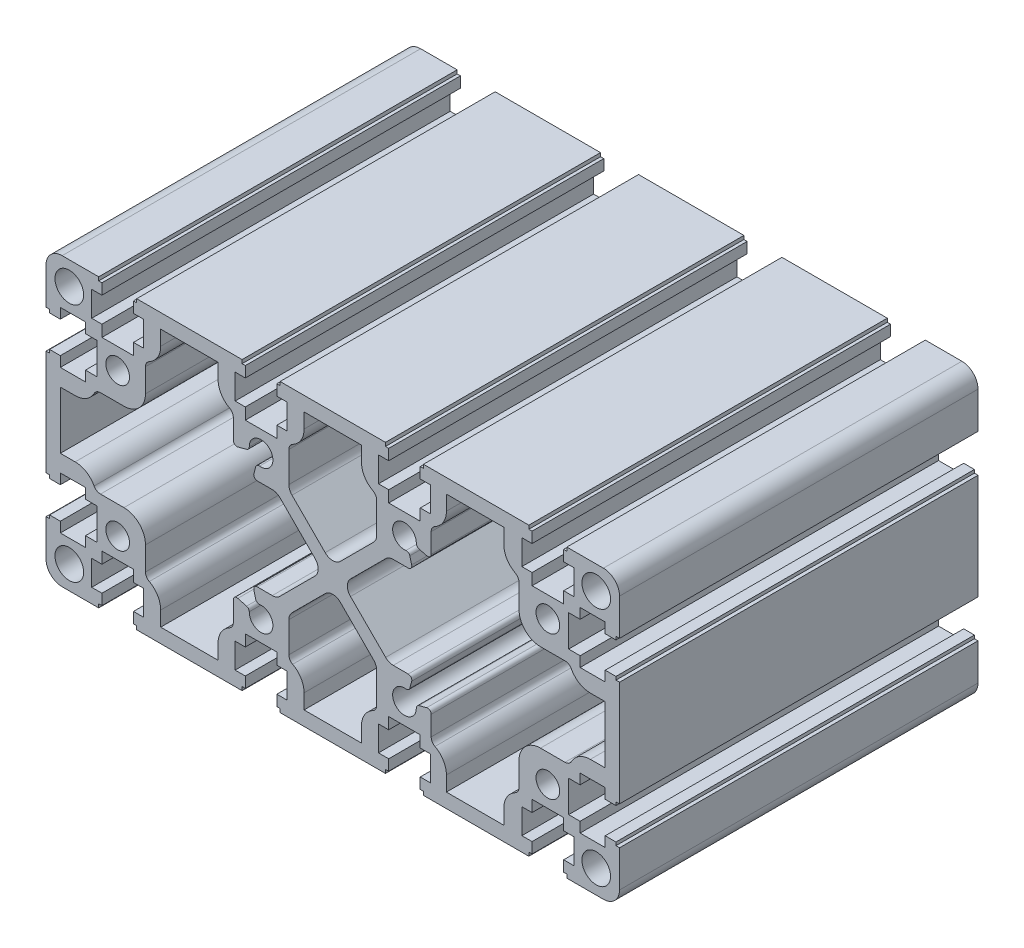
from build123d import *

# Parameters (mm, degrees)
SKETCH_1_R      = 3.3
SKETCH_1_R_2    = 4
EXTRUDE_1_DEPTH = 100
FILLET_1_R      = 3


with BuildPart() as part:
    # 草图1 → 凸台-拉伸1 (new body)
    with BuildSketch(Plane.XY):
        with BuildLine():
            Line((2558.354472588, -1547.201597776), (2587.754472588, -1547.201597776))
            Line((2587.754472588, -1547.201597776), (2587.754472588, -1548.201597776))
            Line((2587.754472588, -1548.201597776), (2588.654472588, -1548.201597776))
            Line((2588.654472588, -1548.201597776), (2588.654472588, -1551.201597776))
            Line((2588.654472588, -1551.201597776), (2585.804472588, -1551.201597776))
            Line((2585.804472588, -1551.201597776), (2585.804472588, -1558.201597776))
            Line((2585.804472588, -1558.201597776), (2588.654472588, -1558.201597776))
            Line((2588.654472588, -1558.201597776), (2588.654472588, -1561.401597776))
            Line((2588.654472588, -1561.401597776), (2597.454472588, -1561.401597776))
            Line((2597.454472588, -1561.401597776), (2597.454472588, -1558.201597776))
            Line((2597.454472588, -1558.201597776), (2600.304472588, -1558.201597776))
            Line((2600.304472588, -1558.201597776), (2600.304472588, -1551.201597776))
            Line((2600.304472588, -1551.201597776), (2597.454472588, -1551.201597776))
            Line((2597.454472588, -1551.201597776), (2597.454472588, -1548.201597776))
            Line((2597.454472588, -1548.201597776), (2598.354472588, -1548.201597776))
            Line((2598.354472588, -1548.201597776), (2598.354472588, -1547.201597776))
            Line((2598.354472588, -1547.201597776), (2627.754472588, -1547.201597776))
            Line((2627.754472588, -1547.201597776), (2627.754472588, -1548.201597776))
            Line((2627.754472588, -1548.201597776), (2628.654472588, -1548.201597776))
            Line((2628.654472588, -1548.201597776), (2628.654472588, -1551.201597776))
            Line((2628.654472588, -1551.201597776), (2625.804472588, -1551.201597776))
            Line((2625.804472588, -1551.201597776), (2625.804472588, -1558.201597776))
            Line((2625.804472588, -1558.201597776), (2628.654472588, -1558.201597776))
            Line((2628.654472588, -1558.201597776), (2628.654472588, -1561.401597776))
            Line((2628.654472588, -1561.401597776), (2637.454472588, -1561.401597776))
            Line((2637.454472588, -1561.401597776), (2637.454472588, -1558.201597776))
            Line((2637.454472588, -1558.201597776), (2640.304472588, -1558.201597776))
            Line((2640.304472588, -1558.201597776), (2640.304472588, -1551.201597776))
            Line((2640.304472588, -1551.201597776), (2637.454472588, -1551.201597776))
            Line((2637.454472588, -1551.201597776), (2637.454472588, -1548.201597776))
            Line((2637.454472588, -1548.201597776), (2638.354472588, -1548.201597776))
            Line((2638.354472588, -1548.201597776), (2638.354472588, -1547.201597776))
            Line((2638.354472588, -1547.201597776), (2667.754472588, -1547.201597776))
            Line((2667.754472588, -1547.201597776), (2667.754472588, -1548.201597776))
            Line((2667.754472588, -1548.201597776), (2668.654472588, -1548.201597776))
            Line((2668.654472588, -1548.201597776), (2668.654472588, -1551.201597776))
            Line((2668.654472588, -1551.201597776), (2665.804472588, -1551.201597776))
            Line((2665.804472588, -1551.201597776), (2665.804472588, -1558.201597776))
            Line((2665.804472588, -1558.201597776), (2668.654472588, -1558.201597776))
            Line((2668.654472588, -1558.201597776), (2668.654472588, -1561.401597776))
            Line((2668.654472588, -1561.401597776), (2677.454472588, -1561.401597776))
            Line((2677.454472588, -1561.401597776), (2677.454472588, -1558.201597776))
            Line((2677.454472588, -1558.201597776), (2680.304472588, -1558.201597776))
            Line((2680.304472588, -1558.201597776), (2680.304472588, -1551.201597776))
            Line((2680.304472588, -1551.201597776), (2677.454472588, -1551.201597776))
            Line((2677.454472588, -1551.201597776), (2677.454472588, -1548.201597776))
            Line((2677.454472588, -1548.201597776), (2678.354472588, -1548.201597776))
            Line((2678.354472588, -1548.201597776), (2678.354472588, -1547.201597776))
            Line((2678.354472588, -1547.201597776), (2688.554472588, -1547.201597776))
            ThreePointArc((2688.554472588, -1547.201597776), (2691.736453103, -1548.519617261), (2693.054472588, -1551.701597776))
            Line((2693.054472588, -1551.701597776), (2693.054472588, -1561.901597776))
            Line((2693.054472588, -1561.901597776), (2692.054472588, -1561.901597776))
            Line((2692.054472588, -1561.901597776), (2692.054472588, -1562.801597776))
            Line((2692.054472588, -1562.801597776), (2689.054472588, -1562.801597776))
            Line((2689.054472588, -1562.801597776), (2689.054472588, -1559.951597776))
            Line((2689.054472588, -1559.951597776), (2682.054472588, -1559.951597776))
            Line((2682.054472588, -1559.951597776), (2682.054472588, -1562.801597776))
            Line((2682.054472588, -1562.801597776), (2678.854472588, -1562.801597776))
            Line((2678.854472588, -1562.801597776), (2678.854472588, -1571.601597776))
            Line((2678.854472588, -1571.601597776), (2682.054472588, -1571.601597776))
            Line((2682.054472588, -1571.601597776), (2682.054472588, -1574.451597776))
            Line((2682.054472588, -1574.451597776), (2689.054472588, -1574.451597776))
            Line((2689.054472588, -1574.451597776), (2689.054472588, -1571.601597776))
            Line((2689.054472588, -1571.601597776), (2692.054472588, -1571.601597776))
            Line((2692.054472588, -1571.601597776), (2692.054472588, -1572.501597776))
            Line((2692.054472588, -1572.501597776), (2693.054472588, -1572.501597776))
            Line((2693.054472588, -1572.501597776), (2693.054472588, -1587.201597776))
            Line((2693.054472588, -1587.201597776), (2693.054472588, -1601.901597776))
            Line((2693.054472588, -1601.901597776), (2692.054472588, -1601.901597776))
            Line((2692.054472588, -1601.901597776), (2692.054472588, -1602.801597776))
            Line((2692.054472588, -1602.801597776), (2689.054472588, -1602.801597776))
            Line((2689.054472588, -1602.801597776), (2689.054472588, -1599.951597776))
            Line((2689.054472588, -1599.951597776), (2682.054472588, -1599.951597776))
            Line((2682.054472588, -1599.951597776), (2682.054472588, -1602.801597776))
            Line((2682.054472588, -1602.801597776), (2678.854472588, -1602.801597776))
            Line((2678.854472588, -1602.801597776), (2678.854472588, -1611.601597776))
            Line((2678.854472588, -1611.601597776), (2682.054472588, -1611.601597776))
            Line((2682.054472588, -1611.601597776), (2682.054472588, -1614.451597776))
            Line((2682.054472588, -1614.451597776), (2689.054472588, -1614.451597776))
            Line((2689.054472588, -1614.451597776), (2689.054472588, -1611.601597776))
            Line((2689.054472588, -1611.601597776), (2692.054472588, -1611.601597776))
            Line((2692.054472588, -1611.601597776), (2692.054472588, -1612.501597776))
            Line((2692.054472588, -1612.501597776), (2693.054472588, -1612.501597776))
            Line((2693.054472588, -1612.501597776), (2693.054472588, -1622.701597776))
            ThreePointArc((2693.054472588, -1622.701597776), (2691.736453103, -1625.883578291), (2688.554472588, -1627.201597776))
            Line((2688.554472588, -1627.201597776), (2678.354472588, -1627.201597776))
            Line((2678.354472588, -1627.201597776), (2678.354472588, -1626.201597776))
            Line((2678.354472588, -1626.201597776), (2677.454472588, -1626.201597776))
            Line((2677.454472588, -1626.201597776), (2677.454472588, -1623.201597776))
            Line((2677.454472588, -1623.201597776), (2680.304472588, -1623.201597776))
            Line((2680.304472588, -1623.201597776), (2680.304472588, -1616.201597776))
            Line((2680.304472588, -1616.201597776), (2677.454472588, -1616.201597776))
            Line((2677.454472588, -1616.201597776), (2677.454472588, -1613.001597776))
            Line((2677.454472588, -1613.001597776), (2668.654472588, -1613.001597776))
            Line((2668.654472588, -1613.001597776), (2668.654472588, -1616.201597776))
            Line((2668.654472588, -1616.201597776), (2665.804472588, -1616.201597776))
            Line((2665.804472588, -1616.201597776), (2665.804472588, -1623.201597776))
            Line((2665.804472588, -1623.201597776), (2668.654472588, -1623.201597776))
            Line((2668.654472588, -1623.201597776), (2668.654472588, -1626.201597776))
            Line((2668.654472588, -1626.201597776), (2667.754472588, -1626.201597776))
            Line((2667.754472588, -1626.201597776), (2667.754472588, -1627.201597776))
            Line((2667.754472588, -1627.201597776), (2638.354472588, -1627.201597776))
            Line((2638.354472588, -1627.201597776), (2638.354472588, -1626.201597776))
            Line((2638.354472588, -1626.201597776), (2637.454472588, -1626.201597776))
            Line((2637.454472588, -1626.201597776), (2637.454472588, -1623.201597776))
            Line((2637.454472588, -1623.201597776), (2640.304472588, -1623.201597776))
            Line((2640.304472588, -1623.201597776), (2640.304472588, -1616.201597776))
            Line((2640.304472588, -1616.201597776), (2637.454472588, -1616.201597776))
            Line((2637.454472588, -1616.201597776), (2637.454472588, -1613.001597776))
            Line((2637.454472588, -1613.001597776), (2628.654472588, -1613.001597776))
            Line((2628.654472588, -1613.001597776), (2628.654472588, -1616.201597776))
            Line((2628.654472588, -1616.201597776), (2625.804472588, -1616.201597776))
            Line((2625.804472588, -1616.201597776), (2625.804472588, -1623.201597776))
            Line((2625.804472588, -1623.201597776), (2628.654472588, -1623.201597776))
            Line((2628.654472588, -1623.201597776), (2628.654472588, -1626.201597776))
            Line((2628.654472588, -1626.201597776), (2627.754472588, -1626.201597776))
            Line((2627.754472588, -1626.201597776), (2627.754472588, -1627.201597776))
            Line((2627.754472588, -1627.201597776), (2598.354472588, -1627.201597776))
            Line((2598.354472588, -1627.201597776), (2598.354472588, -1626.201597776))
            Line((2598.354472588, -1626.201597776), (2597.454472588, -1626.201597776))
            Line((2597.454472588, -1626.201597776), (2597.454472588, -1623.201597776))
            Line((2597.454472588, -1623.201597776), (2600.304472588, -1623.201597776))
            Line((2600.304472588, -1623.201597776), (2600.304472588, -1616.201597776))
            Line((2600.304472588, -1616.201597776), (2597.454472588, -1616.201597776))
            Line((2597.454472588, -1616.201597776), (2597.454472588, -1613.001597776))
            Line((2597.454472588, -1613.001597776), (2588.654472588, -1613.001597776))
            Line((2588.654472588, -1613.001597776), (2588.654472588, -1616.201597776))
            Line((2588.654472588, -1616.201597776), (2585.804472588, -1616.201597776))
            Line((2585.804472588, -1616.201597776), (2585.804472588, -1623.201597776))
            Line((2585.804472588, -1623.201597776), (2588.654472588, -1623.201597776))
            Line((2588.654472588, -1623.201597776), (2588.654472588, -1626.201597776))
            Line((2588.654472588, -1626.201597776), (2587.754472588, -1626.201597776))
            Line((2587.754472588, -1626.201597776), (2587.754472588, -1627.201597776))
            Line((2587.754472588, -1627.201597776), (2558.354472588, -1627.201597776))
            Line((2558.354472588, -1627.201597776), (2558.354472588, -1626.201597776))
            Line((2558.354472588, -1626.201597776), (2557.454472588, -1626.201597776))
            Line((2557.454472588, -1626.201597776), (2557.454472588, -1623.201597776))
            Line((2557.454472588, -1623.201597776), (2560.304472588, -1623.201597776))
            Line((2560.304472588, -1623.201597776), (2560.304472588, -1616.201597776))
            Line((2560.304472588, -1616.201597776), (2557.454472588, -1616.201597776))
            Line((2557.454472588, -1616.201597776), (2557.454472588, -1613.001597776))
            Line((2557.454472588, -1613.001597776), (2548.654472588, -1613.001597776))
            Line((2548.654472588, -1613.001597776), (2548.654472588, -1616.201597776))
            Line((2548.654472588, -1616.201597776), (2545.804472588, -1616.201597776))
            Line((2545.804472588, -1616.201597776), (2545.804472588, -1623.201597776))
            Line((2545.804472588, -1623.201597776), (2548.654472588, -1623.201597776))
            Line((2548.654472588, -1623.201597776), (2548.654472588, -1626.201597776))
            Line((2548.654472588, -1626.201597776), (2547.754472588, -1626.201597776))
            Line((2547.754472588, -1626.201597776), (2547.754472588, -1627.201597776))
            Line((2547.754472588, -1627.201597776), (2537.554472588, -1627.201597776))
            ThreePointArc((2537.554472588, -1627.201597776), (2534.372492072, -1625.883578291), (2533.054472588, -1622.701597776))
            Line((2533.054472588, -1622.701597776), (2533.054472588, -1612.501597776))
            Line((2533.054472588, -1612.501597776), (2534.054472588, -1612.501597776))
            Line((2534.054472588, -1612.501597776), (2534.054472588, -1611.601597776))
            Line((2534.054472588, -1611.601597776), (2537.054472588, -1611.601597776))
            Line((2537.054472588, -1611.601597776), (2537.054472588, -1614.451597776))
            Line((2537.054472588, -1614.451597776), (2544.054472588, -1614.451597776))
            Line((2544.054472588, -1614.451597776), (2544.054472588, -1611.601597776))
            Line((2544.054472588, -1611.601597776), (2547.254472588, -1611.601597776))
            Line((2547.254472588, -1611.601597776), (2547.254472588, -1602.801597776))
            Line((2547.254472588, -1602.801597776), (2544.054472588, -1602.801597776))
            Line((2544.054472588, -1602.801597776), (2544.054472588, -1599.951597776))
            Line((2544.054472588, -1599.951597776), (2537.054472588, -1599.951597776))
            Line((2537.054472588, -1599.951597776), (2537.054472588, -1602.801597776))
            Line((2537.054472588, -1602.801597776), (2534.054472588, -1602.801597776))
            Line((2534.054472588, -1602.801597776), (2534.054472588, -1601.901597776))
            Line((2534.054472588, -1601.901597776), (2533.054472588, -1601.901597776))
            Line((2533.054472588, -1601.901597776), (2533.054472588, -1587.201597776))
            Line((2533.054472588, -1587.201597776), (2533.054472588, -1572.501597776))
            Line((2533.054472588, -1572.501597776), (2534.054472588, -1572.501597776))
            Line((2534.054472588, -1572.501597776), (2534.054472588, -1571.601597776))
            Line((2534.054472588, -1571.601597776), (2537.054472588, -1571.601597776))
            Line((2537.054472588, -1571.601597776), (2537.054472588, -1574.451597776))
            Line((2537.054472588, -1574.451597776), (2544.054472588, -1574.451597776))
            Line((2544.054472588, -1574.451597776), (2544.054472588, -1571.601597776))
            Line((2544.054472588, -1571.601597776), (2547.254472588, -1571.601597776))
            Line((2547.254472588, -1571.601597776), (2547.254472588, -1562.801597776))
            Line((2547.254472588, -1562.801597776), (2544.054472588, -1562.801597776))
            Line((2544.054472588, -1562.801597776), (2544.054472588, -1559.951597776))
            Line((2544.054472588, -1559.951597776), (2537.054472588, -1559.951597776))
            Line((2537.054472588, -1559.951597776), (2537.054472588, -1562.801597776))
            Line((2537.054472588, -1562.801597776), (2534.054472588, -1562.801597776))
            Line((2534.054472588, -1562.801597776), (2534.054472588, -1561.901597776))
            Line((2534.054472588, -1561.901597776), (2533.054472588, -1561.901597776))
            Line((2533.054472588, -1561.901597776), (2533.054472588, -1551.701597776))
            ThreePointArc((2533.054472588, -1551.701597776), (2534.372492072, -1548.519617261), (2537.554472588, -1547.201597776))
            Line((2537.554472588, -1547.201597776), (2547.754472588, -1547.201597776))
            Line((2547.754472588, -1547.201597776), (2547.754472588, -1548.201597776))
            Line((2547.754472588, -1548.201597776), (2548.654472588, -1548.201597776))
            Line((2548.654472588, -1548.201597776), (2548.654472588, -1551.201597776))
            Line((2548.654472588, -1551.201597776), (2545.804472588, -1551.201597776))
            Line((2545.804472588, -1551.201597776), (2545.804472588, -1558.201597776))
            Line((2545.804472588, -1558.201597776), (2548.654472588, -1558.201597776))
            Line((2548.654472588, -1558.201597776), (2548.654472588, -1561.401597776))
            Line((2548.654472588, -1561.401597776), (2557.454472588, -1561.401597776))
            Line((2557.454472588, -1561.401597776), (2557.454472588, -1558.201597776))
            Line((2557.454472588, -1558.201597776), (2560.304472588, -1558.201597776))
            Line((2560.304472588, -1558.201597776), (2560.304472588, -1551.201597776))
            Line((2560.304472588, -1551.201597776), (2557.454472588, -1551.201597776))
            Line((2557.454472588, -1551.201597776), (2557.454472588, -1548.201597776))
            Line((2557.454472588, -1548.201597776), (2558.354472588, -1548.201597776))
            Line((2558.354472588, -1548.201597776), (2558.354472588, -1547.201597776))
        make_face()
        with Locations((2553.054472588, -1567.201597776)):
            Circle(SKETCH_1_R, mode=Mode.SUBTRACT)
        with Locations((2673.054472588, -1567.201597776)):
            Circle(SKETCH_1_R, mode=Mode.SUBTRACT)
        with Locations((2553.054472588, -1607.201597776)):
            Circle(SKETCH_1_R, mode=Mode.SUBTRACT)
        with Locations((2673.054472588, -1607.201597776)):
            Circle(SKETCH_1_R, mode=Mode.SUBTRACT)
        with Locations((2539.554472588, -1553.701597776)):
            Circle(SKETCH_1_R_2, mode=Mode.SUBTRACT)
        with Locations((2539.554472588, -1620.701597776)):
            Circle(SKETCH_1_R_2, mode=Mode.SUBTRACT)
        with Locations((2686.554472588, -1620.701597776)):
            Circle(SKETCH_1_R_2, mode=Mode.SUBTRACT)
        with Locations((2686.554472588, -1553.701597776)):
            Circle(SKETCH_1_R_2, mode=Mode.SUBTRACT)
        with BuildLine():
            Line((2592.00769796, -1574.401597776), (2597.426045463, -1574.401597776))
            Line((2597.426045463, -1574.401597776), (2610.226045463, -1587.201597776))
            Line((2610.226045463, -1587.201597776), (2597.426045463, -1600.001597776))
            Line((2597.426045463, -1600.001597776), (2592.00769796, -1600.001597776))
            ThreePointArc((2592.00769796, -1600.001597776), (2591.21434462, -1600.392836347), (2591.041772134, -1601.260416821))
            Line((2591.041772134, -1601.260416821), (2591.559625209, -1603.193070808))
            ThreePointArc((2591.559625209, -1603.193070808), (2591.966832548, -1603.763609136), (2592.648556048, -1603.926657813))
            ThreePointArc((2592.648556048, -1603.926657813), (2595.503341707, -1609.413619484), (2589.755254751, -1607.12975305))
            ThreePointArc((2589.755254751, -1607.12975305), (2589.555425203, -1606.507893176), (2589.014310815, -1606.142056095))
            Line((2589.014310815, -1606.142056095), (2586.563291633, -1605.485307484))
            ThreePointArc((2586.563291633, -1605.485307484), (2585.695711159, -1605.65787997), (2585.304472588, -1606.45123331))
            Line((2585.304472588, -1606.45123331), (2585.304472588, -1612.001597776))
            ThreePointArc((2585.304472588, -1612.001597776), (2585.018386238, -1613.032374182), (2584.241972588, -1613.768259529))
            ThreePointArc((2584.241972588, -1613.768259529), (2581.912731637, -1615.975915569), (2581.054472588, -1619.068244789))
            Line((2581.054472588, -1619.068244789), (2581.054472588, -1623.201597776))
            Line((2581.054472588, -1623.201597776), (2565.054472588, -1623.201597776))
            Line((2565.054472588, -1623.201597776), (2565.054472588, -1619.068244789))
            ThreePointArc((2565.054472588, -1619.068244789), (2564.196213538, -1615.975915569), (2561.866972588, -1613.768259529))
            ThreePointArc((2561.866972588, -1613.768259529), (2561.090558937, -1613.032374182), (2560.804472588, -1612.001597776))
            Line((2560.804472588, -1612.001597776), (2560.804472588, -1605.451597776))
            ThreePointArc((2560.804472588, -1605.451597776), (2559.047113275, -1601.208957089), (2554.804472588, -1599.451597776))
            Line((2554.804472588, -1599.451597776), (2548.254472588, -1599.451597776))
            ThreePointArc((2548.254472588, -1599.451597776), (2547.223696181, -1599.165511426), (2546.487810834, -1598.389097776))
            ThreePointArc((2546.487810834, -1598.389097776), (2544.280154794, -1596.059856826), (2541.187825575, -1595.201597776))
            Line((2541.187825575, -1595.201597776), (2537.054472588, -1595.201597776))
            Line((2537.054472588, -1595.201597776), (2537.054472588, -1587.201597776))
            Line((2537.054472588, -1587.201597776), (2537.054472588, -1579.201597776))
            Line((2537.054472588, -1579.201597776), (2541.187825575, -1579.201597776))
            ThreePointArc((2541.187825575, -1579.201597776), (2544.280154794, -1578.343338726), (2546.487810834, -1576.014097776))
            ThreePointArc((2546.487810834, -1576.014097776), (2547.223696181, -1575.237684126), (2548.254472588, -1574.951597776))
            Line((2548.254472588, -1574.951597776), (2554.804472588, -1574.951597776))
            ThreePointArc((2554.804472588, -1574.951597776), (2559.047113275, -1573.194238463), (2560.804472588, -1568.951597776))
            Line((2560.804472588, -1568.951597776), (2560.804472588, -1562.401597776))
            ThreePointArc((2560.804472588, -1562.401597776), (2561.090558937, -1561.37082137), (2561.866972588, -1560.634936023))
            ThreePointArc((2561.866972588, -1560.634936023), (2564.196213538, -1558.427279983), (2565.054472588, -1555.334950764))
            Line((2565.054472588, -1555.334950764), (2565.054472588, -1551.201597776))
            Line((2565.054472588, -1551.201597776), (2581.054472588, -1551.201597776))
            Line((2581.054472588, -1551.201597776), (2581.054472588, -1555.334950764))
            ThreePointArc((2581.054472588, -1555.334950764), (2581.912731637, -1558.427279983), (2584.241972588, -1560.634936023))
            ThreePointArc((2584.241972588, -1560.634936023), (2585.018386238, -1561.37082137), (2585.304472588, -1562.401597776))
            Line((2585.304472588, -1562.401597776), (2585.304472588, -1567.951962242))
            ThreePointArc((2585.304472588, -1567.951962242), (2585.695711159, -1568.745315582), (2586.563291633, -1568.917888068))
            Line((2586.563291633, -1568.917888068), (2589.014310815, -1568.261139458))
            ThreePointArc((2589.014310815, -1568.261139458), (2589.555425203, -1567.895302376), (2589.755254751, -1567.273442502))
            ThreePointArc((2589.755254751, -1567.273442502), (2595.503341707, -1564.989576068), (2592.648556048, -1570.476537739))
            ThreePointArc((2592.648556048, -1570.476537739), (2591.966832548, -1570.639586416), (2591.559625209, -1571.210124744))
            Line((2591.559625209, -1571.210124744), (2591.041772134, -1573.142778731))
            ThreePointArc((2591.041772134, -1573.142778731), (2591.21434462, -1574.010359205), (2592.00769796, -1574.401597776))
        make_face(mode=Mode.SUBTRACT)
        with BuildLine():
            Line((2613.054472588, -1584.373170651), (2625.304472588, -1572.123170651))
            Line((2625.304472588, -1572.123170651), (2625.304472588, -1562.401597776))
            ThreePointArc((2625.304472588, -1562.401597776), (2625.018386238, -1561.37082137), (2624.241972588, -1560.634936023))
            ThreePointArc((2624.241972588, -1560.634936023), (2621.912731637, -1558.427279983), (2621.054472588, -1555.334950764))
            Line((2621.054472588, -1555.334950764), (2621.054472588, -1551.201597776))
            Line((2621.054472588, -1551.201597776), (2605.054472588, -1551.201597776))
            Line((2605.054472588, -1551.201597776), (2605.054472588, -1555.334950764))
            ThreePointArc((2605.054472588, -1555.334950764), (2604.196213538, -1558.427279983), (2601.866972588, -1560.634936023))
            ThreePointArc((2601.866972588, -1560.634936023), (2601.090558937, -1561.37082137), (2600.804472588, -1562.401597776))
            Line((2600.804472588, -1562.401597776), (2600.804472588, -1572.123170651))
            Line((2600.804472588, -1572.123170651), (2613.054472588, -1584.373170651))
        make_face(mode=Mode.SUBTRACT)
        with BuildLine():
            Line((2628.682899712, -1574.401597776), (2615.882899712, -1587.201597776))
            Line((2615.882899712, -1587.201597776), (2628.682899712, -1600.001597776))
            Line((2628.682899712, -1600.001597776), (2634.101247215, -1600.001597776))
            ThreePointArc((2634.101247215, -1600.001597776), (2634.894600555, -1600.392836347), (2635.067173041, -1601.260416821))
            Line((2635.067173041, -1601.260416821), (2634.549319966, -1603.193070808))
            ThreePointArc((2634.549319966, -1603.193070808), (2634.142112627, -1603.763609136), (2633.460389127, -1603.926657813))
            ThreePointArc((2633.460389127, -1603.926657813), (2630.605603468, -1609.413619484), (2636.353690424, -1607.12975305))
            ThreePointArc((2636.353690424, -1607.12975305), (2636.553519972, -1606.507893176), (2637.09463436, -1606.142056095))
            Line((2637.09463436, -1606.142056095), (2639.245653542, -1605.565692242))
            ThreePointArc((2639.245653542, -1605.565692242), (2640.113234017, -1605.738264728), (2640.504472588, -1606.531618068))
            Line((2640.504472588, -1606.531618068), (2640.504472588, -1612.001597776))
            ThreePointArc((2640.504472588, -1612.001597776), (2640.790558937, -1613.032374182), (2641.566972588, -1613.768259529))
            ThreePointArc((2641.566972588, -1613.768259529), (2643.896213538, -1615.975915569), (2644.754472588, -1619.068244789))
            Line((2644.754472588, -1619.068244789), (2644.754472588, -1623.201597776))
            Line((2644.754472588, -1623.201597776), (2660.754472588, -1623.201597776))
            Line((2660.754472588, -1623.201597776), (2660.754472588, -1619.068244789))
            ThreePointArc((2660.754472588, -1619.068244789), (2661.612731637, -1615.975915569), (2663.941972588, -1613.768259529))
            ThreePointArc((2663.941972588, -1613.768259529), (2664.718386238, -1613.032374182), (2665.004472588, -1612.001597776))
            Line((2665.004472588, -1612.001597776), (2665.004472588, -1605.451597776))
            ThreePointArc((2665.004472588, -1605.451597776), (2666.7618319, -1601.208957089), (2671.004472588, -1599.451597776))
            Line((2671.004472588, -1599.451597776), (2677.854472588, -1599.451597776))
            ThreePointArc((2677.854472588, -1599.451597776), (2678.885248994, -1599.165511426), (2679.621134341, -1598.389097776))
            ThreePointArc((2679.621134341, -1598.389097776), (2681.828790381, -1596.059856826), (2684.9211196, -1595.201597776))
            Line((2684.9211196, -1595.201597776), (2689.054472588, -1595.201597776))
            Line((2689.054472588, -1595.201597776), (2689.054472588, -1587.201597776))
            Line((2689.054472588, -1587.201597776), (2689.054472588, -1579.201597776))
            Line((2689.054472588, -1579.201597776), (2684.9211196, -1579.201597776))
            ThreePointArc((2684.9211196, -1579.201597776), (2681.828790381, -1578.343338726), (2679.621134341, -1576.014097776))
            ThreePointArc((2679.621134341, -1576.014097776), (2678.885248994, -1575.237684126), (2677.854472588, -1574.951597776))
            Line((2677.854472588, -1574.951597776), (2671.004472588, -1574.951597776))
            ThreePointArc((2671.004472588, -1574.951597776), (2666.7618319, -1573.194238463), (2665.004472588, -1568.951597776))
            Line((2665.004472588, -1568.951597776), (2665.004472588, -1562.401597776))
            ThreePointArc((2665.004472588, -1562.401597776), (2664.718386238, -1561.37082137), (2663.941972588, -1560.634936023))
            ThreePointArc((2663.941972588, -1560.634936023), (2661.612731637, -1558.427279983), (2660.754472588, -1555.334950764))
            Line((2660.754472588, -1555.334950764), (2660.754472588, -1551.201597776))
            Line((2660.754472588, -1551.201597776), (2644.754472588, -1551.201597776))
            Line((2644.754472588, -1551.201597776), (2644.754472588, -1555.334950764))
            ThreePointArc((2644.754472588, -1555.334950764), (2643.896213538, -1558.427279983), (2641.566972588, -1560.634936023))
            ThreePointArc((2641.566972588, -1560.634936023), (2640.790558937, -1561.37082137), (2640.504472588, -1562.401597776))
            Line((2640.504472588, -1562.401597776), (2640.504472588, -1567.871577484))
            ThreePointArc((2640.504472588, -1567.871577484), (2640.113234017, -1568.664930824), (2639.245653542, -1568.83750331))
            Line((2639.245653542, -1568.83750331), (2637.09463436, -1568.261139458))
            ThreePointArc((2637.09463436, -1568.261139458), (2636.553519972, -1567.895302376), (2636.353690424, -1567.273442502))
            ThreePointArc((2636.353690424, -1567.273442502), (2630.605603468, -1564.989576068), (2633.460389127, -1570.476537739))
            ThreePointArc((2633.460389127, -1570.476537739), (2634.142112627, -1570.639586416), (2634.549319966, -1571.210124744))
            Line((2634.549319966, -1571.210124744), (2635.067173041, -1573.142778731))
            ThreePointArc((2635.067173041, -1573.142778731), (2634.894600555, -1574.010359205), (2634.101247215, -1574.401597776))
            Line((2634.101247215, -1574.401597776), (2628.682899712, -1574.401597776))
        make_face(mode=Mode.SUBTRACT)
        with BuildLine():
            Line((2613.054472588, -1590.030024901), (2600.804472588, -1602.280024901))
            Line((2600.804472588, -1602.280024901), (2600.804472588, -1612.001597776))
            ThreePointArc((2600.804472588, -1612.001597776), (2601.090558937, -1613.032374182), (2601.866972588, -1613.768259529))
            ThreePointArc((2601.866972588, -1613.768259529), (2604.196213538, -1615.975915569), (2605.054472588, -1619.068244789))
            Line((2605.054472588, -1619.068244789), (2605.054472588, -1623.201597776))
            Line((2605.054472588, -1623.201597776), (2621.054472588, -1623.201597776))
            Line((2621.054472588, -1623.201597776), (2621.054472588, -1619.068244789))
            ThreePointArc((2621.054472588, -1619.068244789), (2621.912731637, -1615.975915569), (2624.241972588, -1613.768259529))
            ThreePointArc((2624.241972588, -1613.768259529), (2625.018386238, -1613.032374182), (2625.304472588, -1612.001597776))
            Line((2625.304472588, -1612.001597776), (2625.304472588, -1602.280024901))
            Line((2625.304472588, -1602.280024901), (2613.054472588, -1590.030024901))
        make_face(mode=Mode.SUBTRACT)
    extrude(amount=EXTRUDE_1_DEPTH)

    # 圆角1
    fillet_1_edges = [part.edges().sort_by_distance(p)[0] for p in [
        (2628.682899712, -1574.401597776, 50),
        (2615.882899712, -1587.201597776, 50),
        (2628.682899712, -1600.001597776, 50),
        (2597.426045463, -1600.001597776, 50),
        (2610.226045463, -1587.201597776, 50),
        (2597.426045463, -1574.401597776, 50),
        (2600.804472588, -1572.123170651, 50),
        (2613.054472588, -1584.373170651, 50),
        (2625.304472588, -1572.123170651, 50),
        (2625.304472588, -1602.280024901, 50),
        (2613.054472588, -1590.030024901, 50),
        (2600.804472588, -1602.280024901, 50),
    ]]
    fillet(fillet_1_edges, radius=FILLET_1_R)


solid = part.part
